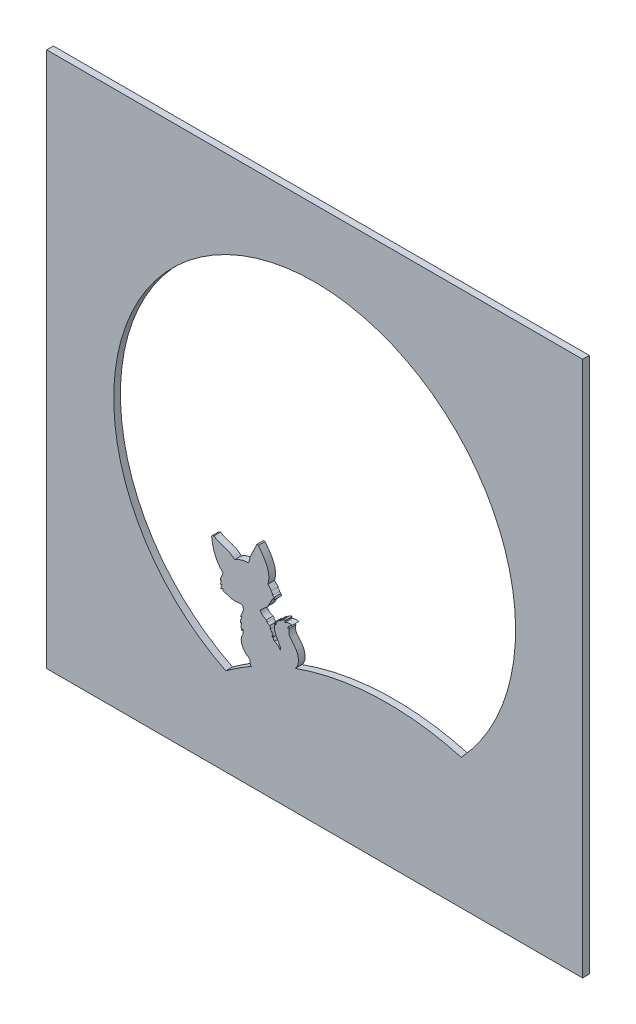
from build123d import *

# Parameters (mm, degrees)
ESQUISSE1_W        = 400
ESQUISSE1_H        = 400
ESQUISSE1_R        = 150
BOSS_EXTRU_1_DEPTH = 5
BOSS_EXTRU_2_START = -5
BOSS_EXTRU_2_DEPTH = 5
BOSS_EXTRU_4_START = -5
BOSS_EXTRU_4_DEPTH = 5


with BuildPart() as part:
    # Esquisse1 → Boss.-Extru.1 (new body)
    with BuildSketch(Plane.XY):
        Rectangle(ESQUISSE1_W, ESQUISSE1_H)
        Circle(ESQUISSE1_R, mode=Mode.SUBTRACT)
    extrude(amount=BOSS_EXTRU_1_DEPTH)

    # Esquisse2 → Boss.-Extru.2 (add)
    with BuildSketch(Plane.XY.offset(5).offset(BOSS_EXTRU_2_START)):
        with BuildLine():
            ThreePointArc((-66.275928016, -134.564116188), (17.903034415, -98.409800426), (109.421717045, -102.600622995))
            ThreePointArc((109.421717045, -102.600622995), (26.84783049, -147.57775577), (-66.275928016, -134.564116188))
        make_face()
    extrude(amount=BOSS_EXTRU_2_DEPTH)

    # Esquisse5 → Boss.-Extru.4 (add)
    with BuildSketch(Plane.XY.offset(5).offset(BOSS_EXTRU_4_START)):
        with BuildLine():
            Line((-18.866345265, -83.351919662), (-20.37407273, -83.74523987))
            add(Edge.make_bspline(
                [(-20.37407273, -83.74523987), (-18.831576298, -81.763764071), (-16.735860805, -80.369241418)],
                knots=[0, 0, 0, 1, 1, 1], degree=2))
            add(Edge.make_bspline(
                [(-16.735860805, -80.369241418), (-19.802386047, -79.615782741), (-22.460949022, -81.422874022)],
                knots=[0, 0, 0, 1, 1, 1], degree=2))
            Line((-22.460949022, -81.422874022), (-21.677782316, -79.558228062))
            add(Edge.make_bspline(
                [(-21.677782316, -79.558228062), (-24.26181325, -80.142481289), (-25.822525036, -82.262094558)],
                knots=[0, 0, 0, 1, 1, 1], degree=2))
            Line((-25.822525036, -82.262094558), (-25.822525036, -81.483648674))
            add(Edge.make_bspline(
                [(-25.822525036, -81.483648674), (-28.351333433, -83.259460466), (-29.053841556, -86.259564776)],
                knots=[0, 0, 0, 1, 1, 1], degree=2))
            Line((-29.053841556, -86.259564776), (-29.496527169, -84.468232294))
            add(Edge.make_bspline(
                [(-29.496527169, -84.468232294), (-30.385431001, -86.732906367), (-30.059960229, -91.485672478), (-26.658406188, -96.353832625), (-25.176717422, -99.770059496), (-25.385021469, -101.387375039)],
                knots=[0, 0, 0, 0, 0.406589929, 0.730891559, 1, 1, 1, 1], degree=3))
            add(Edge.make_bspline(
                [(-25.385021469, -101.387375039), (-26.802377477, -98.375380833), (-29.974054698, -97.359243335)],
                knots=[0, 0, 0, 1, 1, 1], degree=2))
            Line((-29.974054698, -97.359243335), (-32.122945451, -94.451438986))
            Line((-32.122945451, -94.451438986), (-30.527430237, -94.731681614))
            Line((-30.527430237, -94.731681614), (-31.880933057, -92.683136884))
            Line((-31.880933057, -92.683136884), (-33.497007064, -90.538320458))
            Line((-33.497007064, -90.538320458), (-32.581262202, -90.538320458))
            Line((-32.581262202, -90.538320458), (-33.613359396, -89.007007118))
            Line((-33.613359396, -89.007007118), (-36.217522242, -87.522991031))
            Line((-36.217522242, -87.522991031), (-34.976085707, -87.301815556))
            Line((-34.976085707, -87.301815556), (-36.099822643, -86.512016486))
            add(Edge.make_bspline(
                [(-36.099822643, -86.512016486), (-39.217212358, -85.557948169), (-40.645373336, -82.598959987)],
                knots=[0, 0, 0, 1, 1, 1], degree=2))
            add(Edge.make_bspline(
                [(-40.645373336, -82.598959987), (-39.03359815, -80.653112191), (-34.181178142, -77.850858673), (-32.852259513, -72.300227157), (-30.904376568, -70.414710171)],
                knots=[0, 0, 0, 0, 0.487449068, 1, 1, 1, 1], degree=3))
            Line((-30.904376568, -70.414710171), (-31.646902368, -69.877944585))
            Line((-31.646902368, -69.877944585), (-29.609451058, -70.166012753))
            Line((-29.609451058, -70.166012753), (-30.237434638, -69.028235393))
            Line((-30.237434638, -69.028235393), (-32.249484484, -67.755751936))
            Line((-32.249484484, -67.755751936), (-30.841080327, -67.755751936))
            Line((-30.841080327, -67.755751936), (-32.866048633, -66.115953665))
            Line((-32.866048633, -66.115953665), (-32.122945451, -65.705806115))
            Line((-32.122945451, -65.705806115), (-34.976085707, -62.978029277))
            add(Edge.make_bspline(
                [(-34.976085707, -62.978029277), (-34.102733297, -60.394072595), (-33.737935509, -52.117151528), (-39.05614256, -45.345642181), (-42.031693147, -41.294166441)],
                knots=[0, 0, 0, 0, 0.344230119, 1, 1, 1, 1], degree=3))
            Line((-42.031693147, -41.294166441), (-43.185854427, -41.294166441))
            Line((-43.185854427, -41.294166441), (-44.096631121, -43.298315386))
            add(Edge.make_bspline(
                [(-44.096631121, -43.298315386), (-45.231201574, -46.338252094), (-48.330686607, -50.268996334), (-48.834287807, -55.064729459), (-49.3765867, -56.376310655)],
                knots=[0, 0, 0, 0, 0.699335622, 1, 1, 1, 1], degree=3))
            add(Edge.make_bspline(
                [(-49.3765867, -56.376310655), (-53.035018211, -56.310042975), (-56.717874117, -57.429335725), (-59.748293818, -59.471450261)],
                knots=[0, 0, 0, 0, 1, 1, 1, 1], degree=3))
            add(Edge.make_bspline(
                [(-59.748293818, -59.471450261), (-61.730136737, -57.382399641), (-67.02409653, -54.780846239), (-72.769327351, -53.559543058), (-75.231721344, -51.783479704)],
                knots=[0, 0, 0, 0, 0.486790351, 1, 1, 1, 1], degree=3))
            Line((-75.231721344, -51.783479704), (-76.616603351, -52.328679392))
            Line((-76.616603351, -52.328679392), (-76.910233832, -52.974808375))
            add(Edge.make_bspline(
                [(-76.910233832, -52.974808375), (-76.187929468, -60.035339336), (-73.946183278, -67.404517716), (-68.30337696, -72.2011591)],
                knots=[0, 0, 0, 0, 1, 1, 1, 1], degree=3))
            Line((-68.30337696, -72.2011591), (-70.400668481, -77.268167724))
            Line((-70.400668481, -77.268167724), (-70.400668481, -78.023881232))
            Line((-70.400668481, -78.023881232), (-69.598297697, -77.87343671))
            Line((-69.598297697, -77.87343671), (-70.283656075, -80.205357998))
            Line((-70.283656075, -80.205357998), (-70.283656075, -80.865611092))
            Line((-70.283656075, -80.865611092), (-69.087412979, -80.205357998))
            Line((-69.087412979, -80.205357998), (-69.721157599, -81.884742883))
            Line((-69.721157599, -81.884742883), (-69.721157599, -83.255626103))
            Line((-69.721157599, -83.255626103), (-68.175660205, -82.19091787))
            Line((-68.175660205, -82.19091787), (-68.497334605, -83.74523987))
            Line((-68.497334605, -83.74523987), (-67.932636696, -83.958338287))
            add(Edge.make_bspline(
                [(-67.932636696, -83.958338287), (-65.874908009, -84.443832393), (-61.558935468, -86.72875783), (-56.654005751, -85.685370072), (-54.241439725, -85.638363098)],
                knots=[0, 0, 0, 0, 0.460172434, 1, 1, 1, 1], degree=3))
            add(Edge.make_bspline(
                [(-54.241439725, -85.638363098), (-53.550315945, -86.398092796), (-52.60563993, -89.456662165), (-54.737135432, -92.036882428), (-55.189595432, -93.773610113)],
                knots=[0, 0, 0, 0, 0.354288348, 1, 1, 1, 1], degree=3))
            Line((-55.189595432, -93.773610113), (-54.110273533, -93.367103715))
            Line((-54.110273533, -93.367103715), (-55.189595432, -95.920472028))
            Line((-55.189595432, -95.920472028), (-55.189595432, -98.016520642))
            Line((-55.189595432, -98.016520642), (-54.649934483, -97.457574345))
            Line((-54.649934483, -97.457574345), (-54.919764957, -99.950163153))
            Line((-54.919764957, -99.950163153), (-54.649934483, -102.693612698))
            Line((-54.649934483, -102.693612698), (-53.518777052, -101.045082478))
            Line((-53.518777052, -101.045082478), (-53.518777052, -104.785031634))
            add(Edge.make_bspline(
                [(-53.518777052, -104.785031634), (-54.784378844, -106.350541416), (-55.393137974, -111.388492438), (-52.283724717, -115.433656634), (-50.152818663, -117.095817906)],
                knots=[0, 0, 0, 0, 0.414653077, 1, 1, 1, 1], degree=3))
            Line((-50.152818663, -117.095817906), (-50.152818663, -116.458357954))
            Line((-50.152818663, -116.458357954), (-48.056952099, -118.529915166))
            add(Edge.make_bspline(
                [(-48.056952099, -118.529915166), (-48.859432542, -119.698539939), (-48.350236289, -121.515764764), (-47.092095427, -122.118637282)],
                knots=[0, 0, 0, 0, 1, 1, 1, 1], degree=3))
            ThreePointArc((-47.092095427, -122.118637282), (-31.094519185, -113.8787786), (-14.435031904, -107.075896838))
            add(Edge.make_bspline(
                [(-14.435031904, -107.075896838), (-11.14848124, -103.537505901), (-12.000082878, -93.183121296), (-20.698698174, -88.228707084), (-18.866345265, -83.351919662)],
                knots=[0, 0, 0, 0, 0.525387835, 1, 1, 1, 1], degree=3))
        make_face()
    extrude(amount=BOSS_EXTRU_4_DEPTH)


solid = part.part
